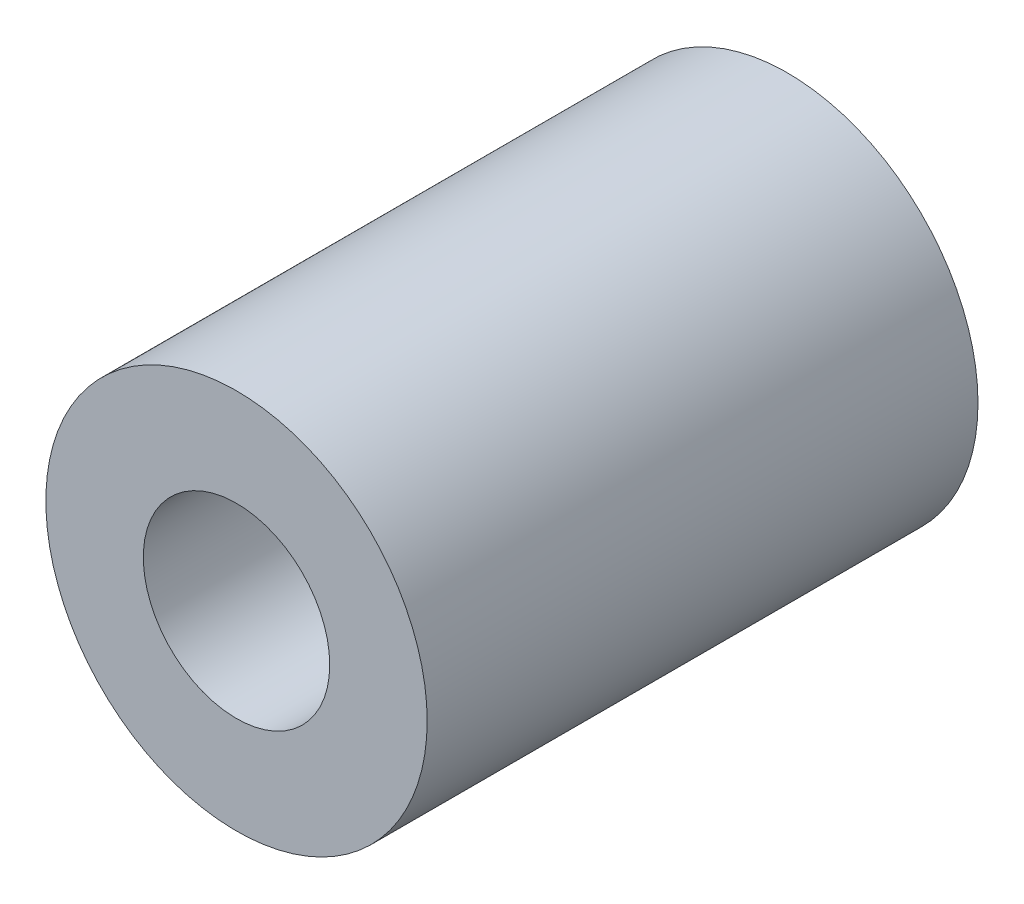
from build123d import *

# Parameters (mm, degrees)
S01_ANNULAR_SECTION_R      = 4.5
S01_ANNULAR_SECTION_R_2    = 2.2
F_01_ANNULAR_SECTION_DEPTH = 13


with BuildPart() as part:
    # S01 - Annular section → 01 - Annular section (new body)
    with BuildSketch(Plane.XY):
        Circle(S01_ANNULAR_SECTION_R)
        Circle(S01_ANNULAR_SECTION_R_2, mode=Mode.SUBTRACT)
    extrude(amount=F_01_ANNULAR_SECTION_DEPTH)


solid = part.part
